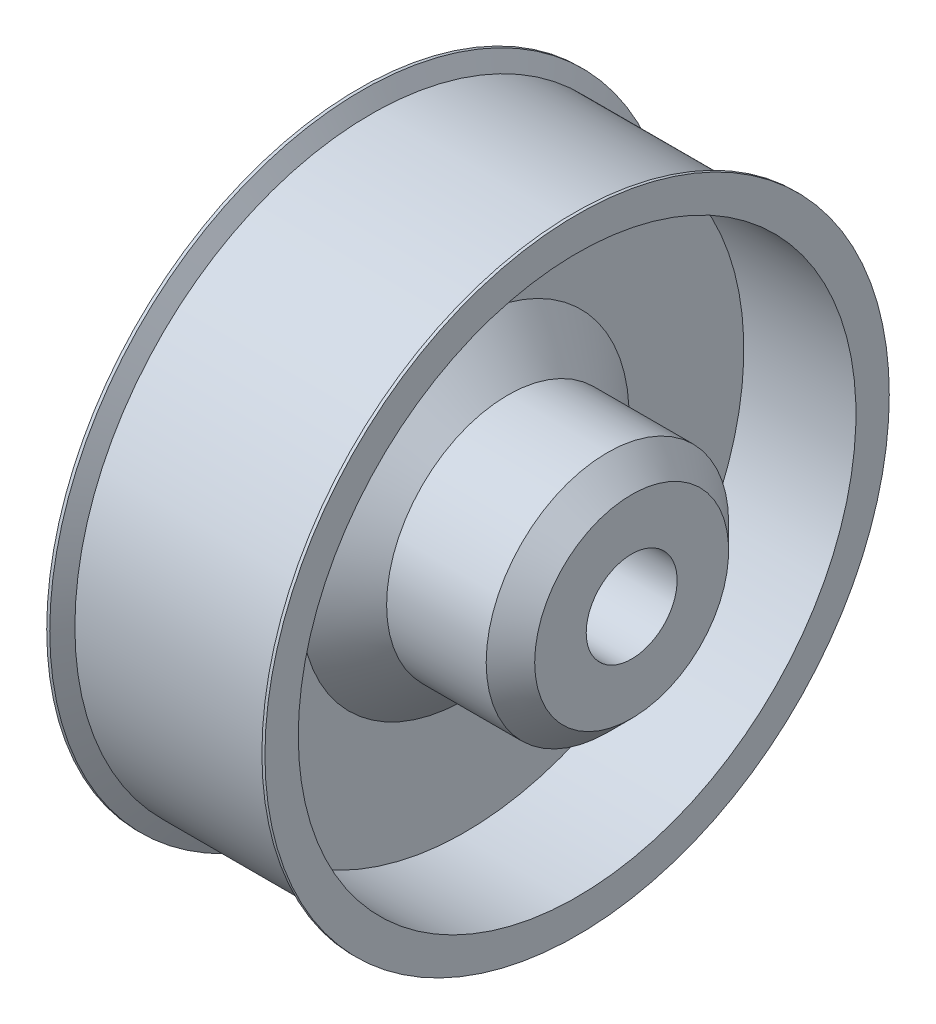
from build123d import *

# Parameters (mm, degrees)
BOSS_EXTRUDE1_DEPTH = 3
CIRPATTERN1_COUNT   = 6
BOSS_EXTRUDE2_DEPTH = 3
CIRPATTERN3_COUNT   = 5


with BuildPart() as part:
    # Sketch1 → Revolve1 (revolve)
    with BuildSketch(Plane.XY, mode=Mode.PRIVATE) as revolve1_sk:
        with BuildLine():
            Line((-7.5, 6), (-17.506303134, 3.75))
            Line((-17.506303134, 3.75), (-18, 0))
            Line((-18, 0), (0, 0))
            Line((0, 0), (0, 7.5))
            Line((0, 7.5), (27.5, 7.5))
            Line((27.5, 7.5), (27.5, 16))
            Line((27.5, 16), (23.5, 20))
            Line((23.5, 20), (7.071067812, 20))
            Line((7.071067812, 20), (0, 27.071067812))
            Line((0, 27.071067812), (0, 46))
            Line((0, 46), (18.5, 46))
            Line((18.5, 46), (18.5, 51.5))
            Line((18.5, 51.5), (18, 51.5))
            Line((18, 51.5), (16.5, 48.854271037))
            Line((16.5, 48.854271037), (-15.5, 48.854271037))
            Line((-15.5, 48.854271037), (-17, 51.5))
            Line((-17, 51.5), (-17.5, 51.5))
            Line((-17.5, 51.5), (-17.5, 48))
            ThreePointArc((-17.5, 48), (-16.914213562, 46.585786438), (-15.5, 46))
            Line((-15.5, 46), (-10.5, 46))
            ThreePointArc((-10.5, 46), (-8.378679656, 45.121320344), (-7.5, 43))
            Line((-7.5, 43), (-7.5, 33.062305899))
            ThreePointArc((-7.5, 33.062305899), (-8.094648823, 31.269462985), (-9.642857143, 30.187361356))
            ThreePointArc((-9.642857143, 30.187361356), (-15, 23), (-9.642857143, 15.812638644))
            ThreePointArc((-9.642857143, 15.812638644), (-8.094648823, 14.730537015), (-7.5, 12.937694101))
            Line((-7.5, 12.937694101), (-7.5, 6))
        make_face()
    revolve(revolve1_sk.sketch.rotate(Axis((-18, 0, 0), (1, 0, 0)), 90), axis=Axis((-18, 0, 0), (1, 0, 0)))

    # Sketch2 → Boss-Extrude1 (add)
    with BuildSketch(Plane.ZY.offset(7.5)):
        Polygon((-2.886751346, 37.5), (-1.443375673, 35), (1.443375673, 35), (2.886751346, 37.5), (1.443375673, 40), (-1.443375673, 40), align=None)
    boss_extrude1 = extrude(amount=BOSS_EXTRUDE1_DEPTH)

    # CirPattern1: Boss-Extrude1 ×6 about axis
    cirpattern1_axis = Axis((0, 0, 0), (1, 0, 0))
    for i in range(1, CIRPATTERN1_COUNT):
        add(boss_extrude1.rotate(cirpattern1_axis, i * 360 / CIRPATTERN1_COUNT))

    # Sketch3 → Boss-Extrude2 (add)
    with BuildSketch(Plane.ZY.offset(7.5)):
        Polygon((-1.443375673, 12.5), (-2.886751346, 10), (-1.443375673, 7.5), (1.443375673, 7.5), (2.886751346, 10), (1.443375673, 12.5), align=None)
    boss_extrude2 = extrude(amount=BOSS_EXTRUDE2_DEPTH)

    # CirPattern3: Boss-Extrude2 ×5 about axis
    cirpattern3_axis = Axis((0, 0, 0), (1, 0, 0))
    for i in range(1, CIRPATTERN3_COUNT):
        add(boss_extrude2.rotate(cirpattern3_axis, i * 360 / CIRPATTERN3_COUNT))


solid = part.part
